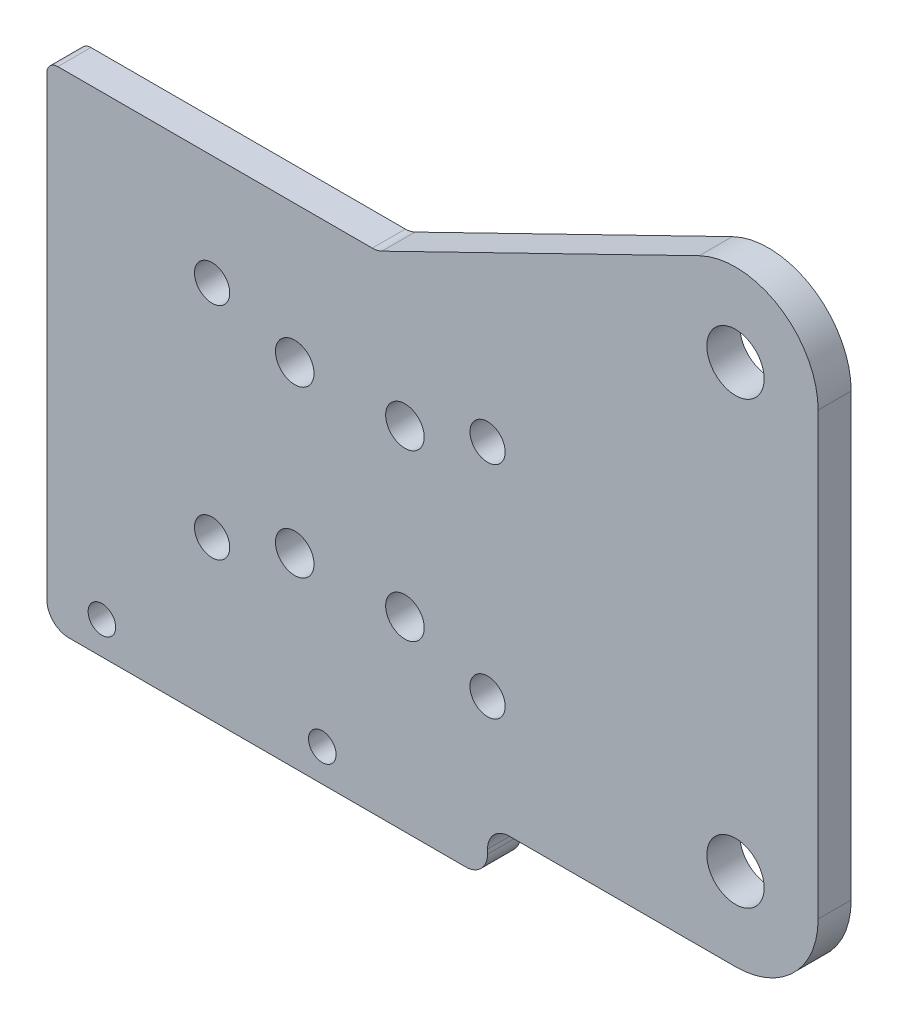
from build123d import *

# Parameters (mm, degrees)
SKETCH_1_R          = 2.6
EXTRUDE_1_DEPTH     = 3
CUT_EXTRUDE_START   = -3
CUT_EXTRUDE_1_DEPTH = 3
SKETCH_3_R          = 1.6
CUT_EXTRUDE_2_DEPTH = 3
FILLET_1_R          = 1
SKETCH_4_R          = 1.75
CUT_EXTRUDE_3_DEPTH = 10
SKETCH_5_W          = 40
SKETCH_5_H          = 5.4
EXTRUDE_2_DEPTH     = 3
SKETCH_6_R          = 1.25
CUT_EXTRUDE_4_DEPTH = 4
FILLET_2_R          = 2


with BuildPart() as part:
    # 草图1 → 凸台-拉伸1 (new body)
    with BuildSketch(Plane.XY):
        with BuildLine():
            Line((-35, -27.5), (27.5, -27.5))
            ThreePointArc((27.5, -27.5), (32.803300859, -25.303300859), (35, -20))
            Line((35, -20), (35, 20))
            ThreePointArc((35, 20), (32.803300859, 25.303300859), (27.5, 27.5))
            Line((27.5, 27.5), (-35, 27.5))
            Line((-35, 27.5), (-35, -27.5))
        make_face()
        with Locations((27.5, 20)):
            Circle(SKETCH_1_R, mode=Mode.SUBTRACT)
        with Locations(Location((27.5, -20, 0), (0, 0, 180))):
            Circle(SKETCH_1_R, mode=Mode.SUBTRACT)
    extrude(amount=EXTRUDE_1_DEPTH)

    # 草图2 → 切除-拉伸1 (cut)
    with BuildSketch(Plane.XY.offset(3).offset(CUT_EXTRUDE_START)):
        with BuildLine():
            Line((-35, 12.5), (-5, 12.5))
            Line((-5, 12.5), (24.213483146, 26.741573034))
            ThreePointArc((24.213483146, 26.741573034), (25.8135537, 27.307933968), (27.5, 27.5))
            Line((27.5, 27.5), (27.5, 37.5))
            Line((27.5, 37.5), (-35, 37.5))
            Line((-35, 37.5), (-35, 12.5))
        make_face()
    extrude(amount=CUT_EXTRUDE_1_DEPTH, mode=Mode.SUBTRACT)

    # 草图3 → 切除-拉伸2 (cut)
    with BuildSketch(Plane.XY.offset(3)):
        with Locations((-20, 2.5)):
            Circle(SKETCH_3_R)
        with Locations(Location((5, 2.5, 0), (0, 0, 180))):
            Circle(SKETCH_3_R)
        with Locations((5, -17.5)):
            Circle(SKETCH_3_R)
        with Locations(Location((-20, -17.5, 0), (0, 0, 180))):
            Circle(SKETCH_3_R)
    extrude(amount=-CUT_EXTRUDE_2_DEPTH, mode=Mode.SUBTRACT)

    # 圆角1
    fillet_1_edges = [part.edges().sort_by_distance(p)[0] for p in [
        (-35, -27.5, 1.5),
        (-35, 12.5, 1.5),
    ]]
    fillet(fillet_1_edges, radius=FILLET_1_R)

    # 草图4 → 切除-拉伸3 (cut)
    with BuildSketch(Plane.XY.offset(3)):
        with Locations((-2.5, 0)):
            Circle(SKETCH_4_R)
        with Locations((-12.5, 0)):
            Circle(SKETCH_4_R)
        with Locations((-12.5, -15)):
            Circle(SKETCH_4_R)
        with Locations((-2.5, -15)):
            Circle(SKETCH_4_R)
    extrude(amount=-CUT_EXTRUDE_3_DEPTH, mode=Mode.SUBTRACT)

    # 草图5 → 凸台-拉伸2 (add)
    with BuildSketch(Plane(origin=(0, 0, 0), x_dir=(-1, 0, 0), z_dir=(0, 0, -1))):
        with Locations((15, -29.2)):
            Rectangle(SKETCH_5_W, SKETCH_5_H)
    extrude(amount=-EXTRUDE_2_DEPTH)

    # 草图6 → 切除-拉伸4 (cut)
    with BuildSketch(Plane(origin=(0, 0, 0), x_dir=(-1, 0, 0), z_dir=(0, 0, -1))):
        with Locations((30, -28.95)):
            Circle(SKETCH_6_R)
        with Locations((10, -28.95)):
            Circle(SKETCH_6_R)
    extrude(amount=-CUT_EXTRUDE_4_DEPTH, mode=Mode.SUBTRACT)

    # 圆角2
    fillet_2_edges = [part.edges().sort_by_distance(p)[0] for p in [
        (5, -27.5, 1.5),
        (5, -31.9, 1.5),
        (-35, -31.9, 1.5),
        (-5, 12.5, 1.5),
    ]]
    fillet(fillet_2_edges, radius=FILLET_2_R)


solid = part.part
